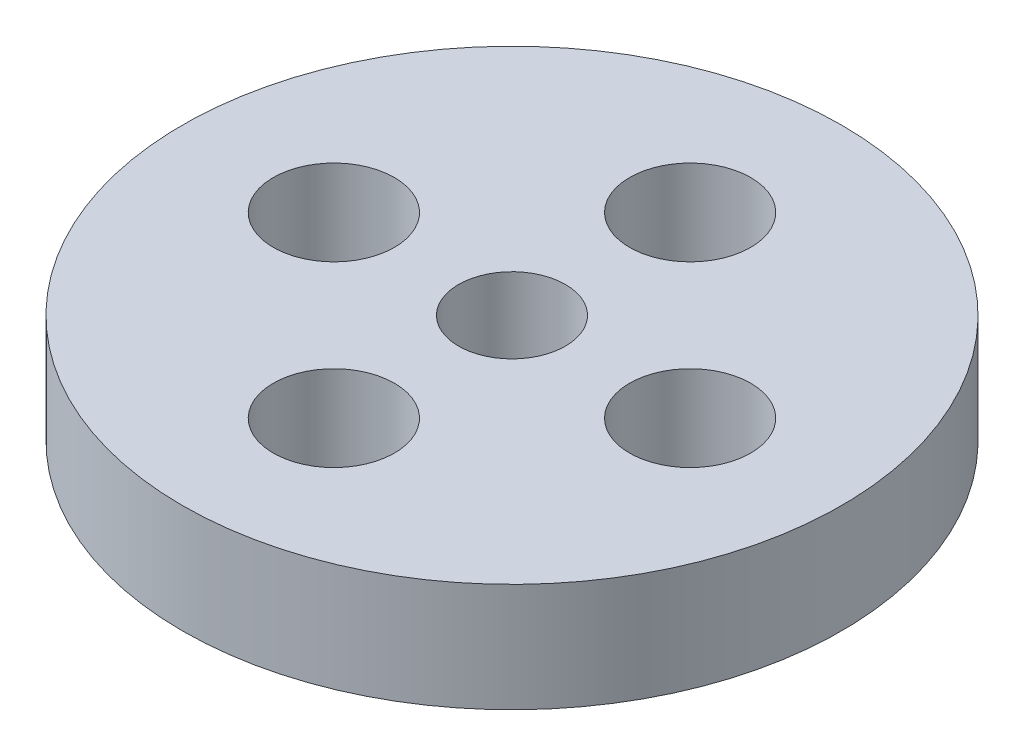
from build123d import *

# Parameters (mm, degrees)
SKETCH1_R           = 9.25
SKETCH1_R_2         = 1.7
SKETCH1_R_3         = 1.5
BOSS_EXTRUDE1_DEPTH = 3.048


with BuildPart() as part:
    # Sketch1 → Boss-Extrude1 (new body)
    with BuildSketch(Plane(origin=(0, 0, 0), x_dir=(1, 0, 0), z_dir=(0, 1, 0))):
        with Locations(Location((0, 0, 0), (0, 0, 90))):
            Circle(SKETCH1_R)
        with Locations(Location((0, 5, 0), (0, 0, 90))):
            Circle(SKETCH1_R_2, mode=Mode.SUBTRACT)
        with Locations(Location((-5, 0, 0), (0, 0, 90))):
            Circle(SKETCH1_R_2, mode=Mode.SUBTRACT)
        with Locations(Location((0, -5, 0), (0, 0, 90))):
            Circle(SKETCH1_R_2, mode=Mode.SUBTRACT)
        with Locations(Location((5, 0, 0), (0, 0, 90))):
            Circle(SKETCH1_R_2, mode=Mode.SUBTRACT)
        with Locations(Location((0, 0, 0), (0, 0, 90))):
            Circle(SKETCH1_R_3, mode=Mode.SUBTRACT)
    extrude(amount=BOSS_EXTRUDE1_DEPTH)


solid = part.part
